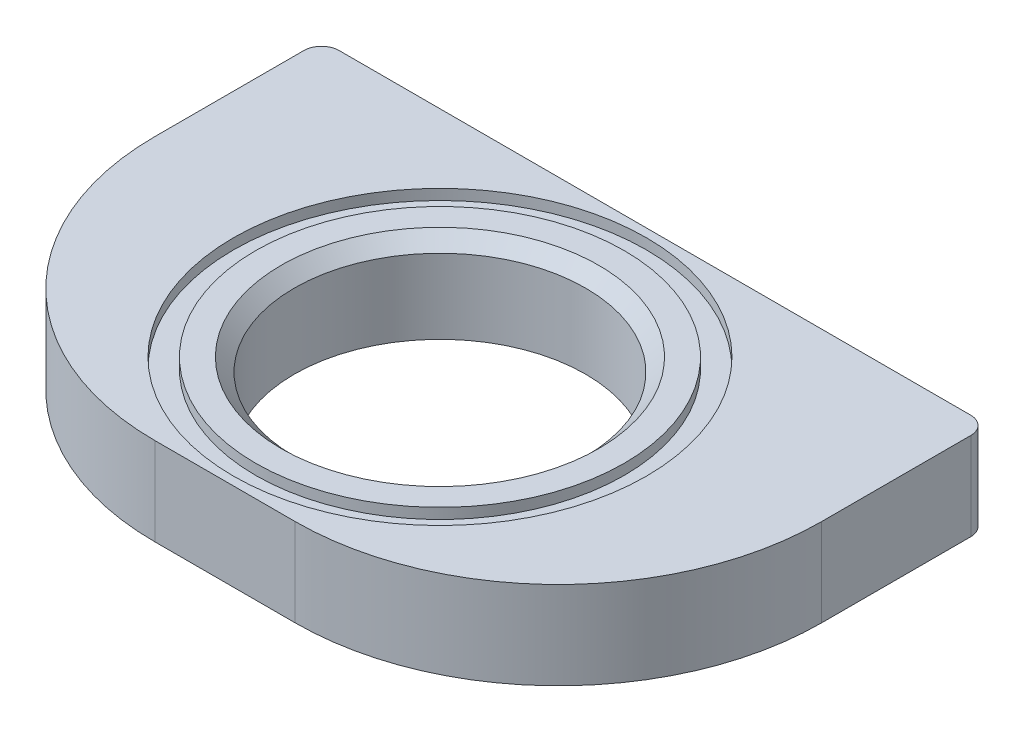
from build123d import *

# Parameters (mm, degrees)
SKETCH1_W           = 38
SKETCH1_H           = 24.5
SKETCH1_R           = 8.3
BOSS_EXTRUDE1_DEPTH = 5
FILLET1_R           = 15
FILLET2_R           = 1
CHAMFER1_SIZE       = 0.75
SKETCH3_W           = 1.267094865
SKETCH3_H           = 1.151259449


with BuildPart() as part:
    # Sketch1 → Boss-Extrude1 (new body)
    with BuildSketch(Plane(origin=(0, 0, 0), x_dir=(1, 0, 0), z_dir=(0, 1, 0))):
        Rectangle(SKETCH1_W, SKETCH1_H)
        with Locations(Location((0, 0, 0), (0, 0, 270))):
            Circle(SKETCH1_R, mode=Mode.SUBTRACT)
    extrude(amount=BOSS_EXTRUDE1_DEPTH)

    # Fillet1
    fillet1_edges = [part.edges().sort_by_distance(p)[0] for p in [
        (19, 2.5, 12.25),
        (-19, 2.5, 12.25),
    ]]
    fillet(fillet1_edges, radius=FILLET1_R)

    # Fillet2
    fillet2_edges = [part.edges().sort_by_distance(p)[0] for p in [
        (-19, 2.5, -12.25),
        (19, 2.5, -12.25),
    ]]
    fillet(fillet2_edges, radius=FILLET2_R)

    # Chamfer1
    chamfer1_edges = [part.edges().sort_by_distance(p)[0] for p in [
        (0, 5, -8.3),
    ]]
    chamfer(chamfer1_edges, length=CHAMFER1_SIZE)

    # o-ring: sweep along a path in Sketch4
    with BuildLine(Plane(origin=(0, 5, 0), x_dir=(1, 0, 0), z_dir=(0, 1, 0))) as o_ring_path:
        CenterArc((0, 0), 11, 0, 360)
    # Sketch3 → o-ring (sweep, cut)
    with BuildSketch(Plane.XY):
        with Locations((-11.133547433, 4.975629725)):
            Rectangle(SKETCH3_W, SKETCH3_H)
    sweep(path=o_ring_path.line, mode=Mode.SUBTRACT)


solid = part.part
